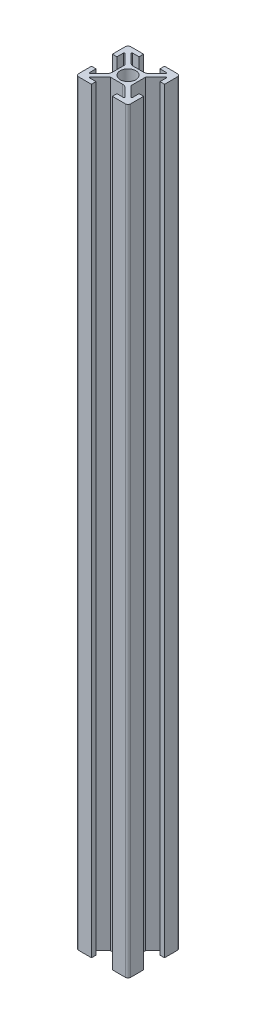
from build123d import *

# Parameters (mm, degrees)
ESBO_O1_W                = 20
ESBO_O1_H                = 20
ESBO_O1_R                = 3
RESSALTO_EXTRUS_O1_DEPTH = 145
ESBO_O2_W                = 8
ESBO_O2_H                = 1.75
CORTE_EXTRUS_O1_DEPTH    = 291.344622819
PADR_OCIRCULAR2_COUNT    = 4
FILETE2_R                = 1
FILETE3_R                = 2
FILETE4_R                = 0.25


with BuildPart() as part:
    # Esboço1 → Ressalto-extrusão1 (new, symmetric)
    with BuildSketch(Plane(origin=(0, 0, 0), x_dir=(1, 0, 0), z_dir=(0, 1, 0))):
        Rectangle(ESBO_O1_W, ESBO_O1_H)
        with Locations(Location((0, 0, 0), (0, 0, 270))):
            Circle(ESBO_O1_R, mode=Mode.SUBTRACT)
    extrude(amount=RESSALTO_EXTRUS_O1_DEPTH, both=True)

    # Esboço2 → Corte-extrusão1 (cut, through all)
    with BuildSketch(Plane(origin=(0, 145, 0), x_dir=(1, 0, 0), z_dir=(0, 1, 0))):
        Polygon((-7.05, 8.25), (-2.8, 4), (2.8, 4), (7.05, 8.25), (4, 8.25), (-4, 8.25), align=None)
        with Locations((0, 9.125)):
            Rectangle(ESBO_O2_W, ESBO_O2_H)
    corte_extrus_o1 = extrude(amount=-CORTE_EXTRUS_O1_DEPTH, mode=Mode.SUBTRACT)

    # PadrãoCircular2: Corte-extrusão1 ×4 about axis
    padr_ocircular2_axis = Axis((0, 0, 0), (0, 1, 0))
    for i in range(1, PADR_OCIRCULAR2_COUNT):
        add(corte_extrus_o1.rotate(padr_ocircular2_axis, i * 360 / PADR_OCIRCULAR2_COUNT), mode=Mode.SUBTRACT)

    # Filete2
    filete2_edges = [part.edges().sort_by_distance(p)[0] for p in [
        (10, 0, 10),
        (-10, 0, 10),
        (-10, 0, -10),
        (10, 0, -10),
    ]]
    fillet(filete2_edges, radius=FILETE2_R)

    # Filete3
    filete3_edges = [part.edges().sort_by_distance(p)[0] for p in [
        (-4, 0, 2.8),
        (2.8, 0, -4),
        (-2.8, 0, -4),
        (2.8, 0, 4),
    ]]
    fillet(filete3_edges, radius=FILETE3_R)

    # Filete4
    filete4_edges = [part.edges().sort_by_distance(p)[0] for p in [
        (-8.25, 0, -7.05),
        (-8.25, 0, 7.05),
        (7.05, 0, -8.25),
        (-7.05, 0, -8.25),
        (8.25, 0, 7.05),
        (8.25, 0, -7.05),
        (-7.05, 0, 8.25),
        (7.05, 0, 8.25),
    ]]
    fillet(filete4_edges, radius=FILETE4_R)


solid = part.part
